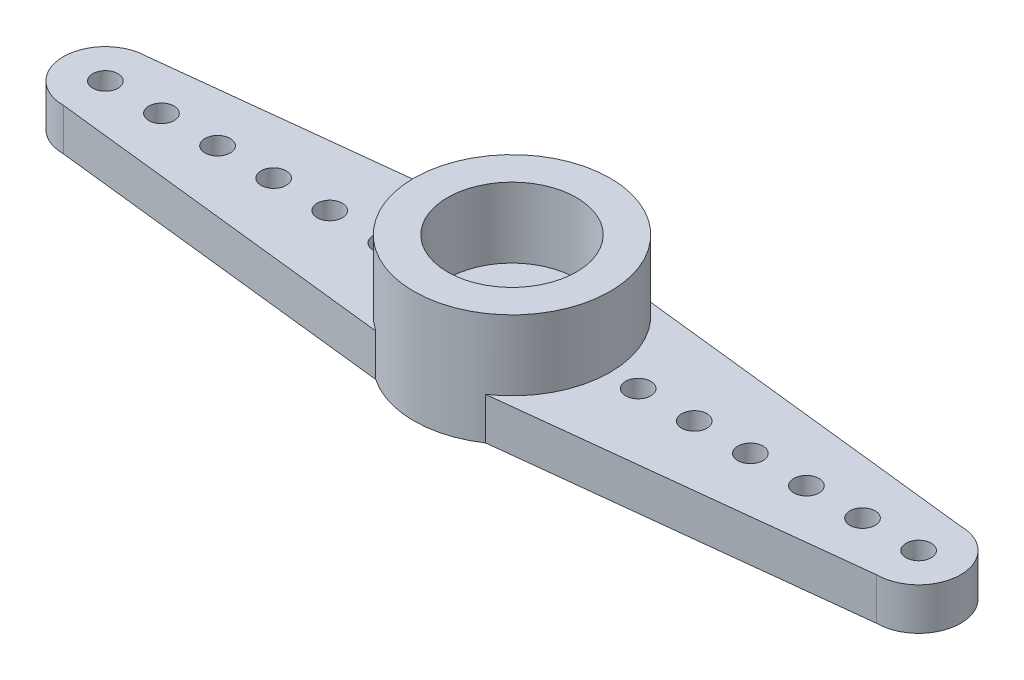
from build123d import *

# Parameters (mm, degrees)
SKETCH1_R           = 0.45
SKETCH1_R_2         = 3.5
SKETCH1_R_3         = 2.3
SKETCH1_R_4         = 1.2
BOSS_EXTRUDE1_DEPTH = 1.5
BOSS_EXTRUDE2_START = 1.5
SKETCH1_4_R         = 3.5
SKETCH1_4_R_2       = 2.3
BOSS_EXTRUDE2_DEPTH = 2.5
SKETCH1_5_R         = 2.3
SKETCH1_5_R_2       = 1.2
CUT_EXTRUDE1_DEPTH  = 0.5


with BuildPart() as part:
    # Sketch1 → Boss-Extrude1 (new body)
    # profile 1 of 4: a face of its own
    with BuildSketch(Plane(origin=(0, 0, 0), x_dir=(1, 0, 0), z_dir=(0, 1, 0))):
        with BuildLine():
            ThreePointArc((-1.959591794, -2.9), (-3.5, 0), (-1.959591794, 2.9))
            Line((-1.959591794, 2.9), (-14.5, 1.5))
            ThreePointArc((-14.5, 1.5), (-16, 0), (-14.5, -1.5))
            Line((-14.5, -1.5), (-1.959591794, -2.9))
        make_face()
        with Locations(Location((-14.5, 0, 0), (0, 0, 270))):
            Circle(SKETCH1_R, mode=Mode.SUBTRACT)
        with Locations(Location((-12.5, 0, 0), (0, 0, 270))):
            Circle(SKETCH1_R, mode=Mode.SUBTRACT)
        with Locations(Location((-10.5, 0, 0), (0, 0, 270))):
            Circle(SKETCH1_R, mode=Mode.SUBTRACT)
        with Locations(Location((-8.5, 0, 0), (0, 0, 270))):
            Circle(SKETCH1_R, mode=Mode.SUBTRACT)
        with Locations(Location((-6.5, 0, 0), (0, 0, 270))):
            Circle(SKETCH1_R, mode=Mode.SUBTRACT)
        with Locations(Location((-4.5, 0, 0), (0, 0, 270))):
            Circle(SKETCH1_R, mode=Mode.SUBTRACT)
    # profile 2 of 4: a face of its own
    with BuildSketch(Plane(origin=(0, 0, 0), x_dir=(1, 0, 0), z_dir=(0, 1, 0))):
        with BuildLine():
            Line((14.5, 1.5), (1.959591794, 2.9))
            ThreePointArc((1.959591794, 2.9), (3.091000751, 1.641863076), (3.5, 0))
            ThreePointArc((3.5, 0), (3.091000751, -1.641863076), (1.959591794, -2.9))
            Line((1.959591794, -2.9), (14.5, -1.5))
            ThreePointArc((14.5, -1.5), (16, 0), (14.5, 1.5))
        make_face()
        with Locations(Location((4.5, 0, 0), (0, 0, 270))):
            Circle(SKETCH1_R, mode=Mode.SUBTRACT)
        with Locations(Location((6.5, 0, 0), (0, 0, 270))):
            Circle(SKETCH1_R, mode=Mode.SUBTRACT)
        with Locations(Location((8.5, 0, 0), (0, 0, 270))):
            Circle(SKETCH1_R, mode=Mode.SUBTRACT)
        with Locations(Location((10.5, 0, 0), (0, 0, 270))):
            Circle(SKETCH1_R, mode=Mode.SUBTRACT)
        with Locations(Location((12.5, 0, 0), (0, 0, 270))):
            Circle(SKETCH1_R, mode=Mode.SUBTRACT)
        with Locations(Location((14.5, 0, 0), (0, 0, 270))):
            Circle(SKETCH1_R, mode=Mode.SUBTRACT)
    # profile 3 of 4: a face of its own
    with BuildSketch(Plane(origin=(0, 0, 0), x_dir=(1, 0, 0), z_dir=(0, 1, 0))):
        Circle(SKETCH1_R_2)
        Circle(SKETCH1_R_3, mode=Mode.SUBTRACT)
    # profile 4 of 4: a face of its own
    with BuildSketch(Plane(origin=(0, 0, 0), x_dir=(1, 0, 0), z_dir=(0, 1, 0))):
        Circle(SKETCH1_R_3)
        with Locations(Location((0, 0, 0), (0, 0, 270))):
            Circle(SKETCH1_R_4, mode=Mode.SUBTRACT)
    extrude(amount=BOSS_EXTRUDE1_DEPTH)

    # Sketch1<4> → Boss-Extrude2 (add)
    with BuildSketch(Plane(origin=(0, 0, 0), x_dir=(1, 0, 0), z_dir=(0, 1, 0)).offset(BOSS_EXTRUDE2_START)):
        with Locations(Location((0, 0, 0), (0, 0, 124.04773237))):
            Circle(SKETCH1_4_R)
        with Locations(Location((0, 0, 0), (0, 0, 270))):
            Circle(SKETCH1_4_R_2, mode=Mode.SUBTRACT)
    extrude(amount=BOSS_EXTRUDE2_DEPTH)

    # Sketch1<5> → Cut-Extrude1 (cut)
    with BuildSketch(Plane(origin=(0, 0, 0), x_dir=(1, 0, 0), z_dir=(0, 1, 0))):
        with Locations(Location((0, 0, 0), (0, 0, 270))):
            Circle(SKETCH1_5_R)
        with Locations(Location((0, 0, 0), (0, 0, 270))):
            Circle(SKETCH1_5_R_2, mode=Mode.SUBTRACT)
    extrude(amount=CUT_EXTRUDE1_DEPTH, mode=Mode.SUBTRACT)


solid = part.part
